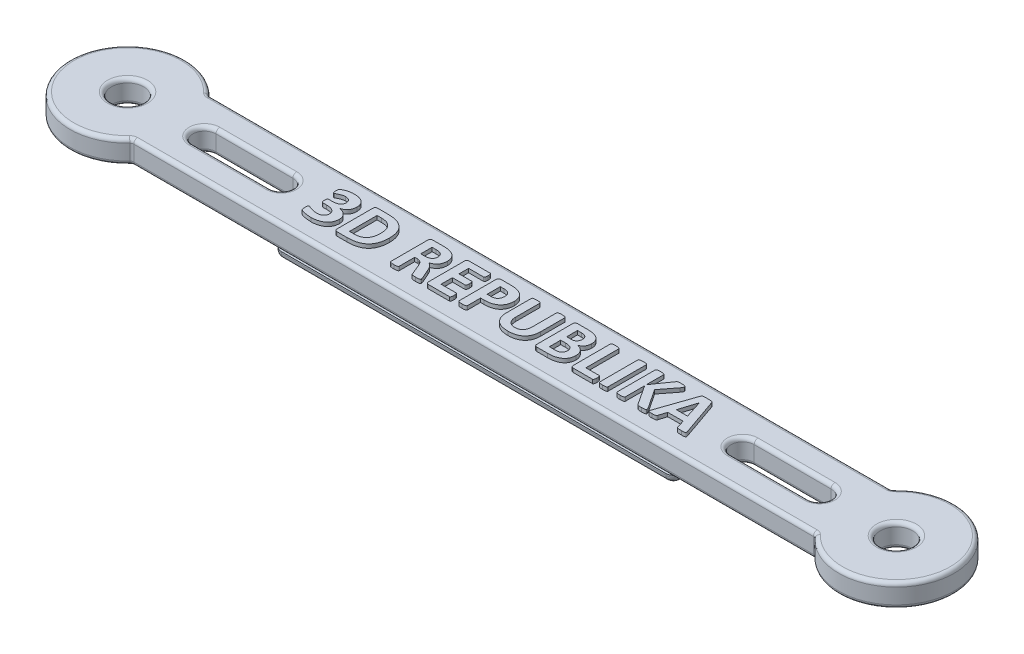
from build123d import *

# Parameters (mm, degrees)
SKETCH1_R           = 2.1
BOSS_EXTRUDE1_DEPTH = 3
BOSS_EXTRUDE2_DEPTH = 0.5
CUT_EXTRUDE1_DEPTH  = 6
SKETCH4_W           = 52
SKETCH4_H           = 10
BOSS_EXTRUDE3_DEPTH = 1
FILLET1_R           = 1
FILLET2_R           = 0.8
FILLET3_R           = 0.5


with BuildPart() as part:
    # Sketch1 → Boss-Extrude1 (new body)
    with BuildSketch(Plane(origin=(0, 0, 0), x_dir=(1, 0, 0), z_dir=(0, 1, 0))):
        with BuildLine():
            Line((5.590169944, 5), (94.409830056, 5))
            ThreePointArc((94.409830056, 5), (107.5, 0), (94.409830056, -5))
            Line((94.409830056, -5), (5.590169944, -5))
            ThreePointArc((5.590169944, -5), (-7.5, 0), (5.590169944, 5))
        make_face()
        with Locations(Location((0, 0, 0), (0, 0, 270))):
            Circle(SKETCH1_R, mode=Mode.SUBTRACT)
        with Locations(Location((100, 0, 0), (0, 0, 270))):
            Circle(SKETCH1_R, mode=Mode.SUBTRACT)
    extrude(amount=BOSS_EXTRUDE1_DEPTH)

    # Sketch2 → Boss-Extrude2 (add)
    # profile 1 of 11: a face of its own
    with BuildSketch(Plane(origin=(0, 3, 0), x_dir=(1, 0, 0), z_dir=(0, 1, 0))):
        with BuildLine():
            add(Edge.make_bspline(
                [(28.638786765, -1.080574708), (28.636898147, -1.145115168), (28.633220992, -1.27077595), (28.605128722, -1.454230842), (28.556381389, -1.625964737), (28.48920155, -1.78633027), (28.404760487, -1.934319512), (28.304419794, -2.069928773), (28.189313461, -2.193386373), (28.060009717, -2.304915373), (27.915137095, -2.40130189), (27.759049483, -2.489124431), (27.587730195, -2.561189115), (27.404418496, -2.621989464), (27.209915705, -2.668792237), (27.006030414, -2.703227842), (26.792981859, -2.722214214), (26.64796189, -2.725336245), (26.574161305, -2.726925045)],
                knots=[0, 0, 0, 0, 1.041492781, 2.0277946, 2.986615217, 3.916084947, 4.827326187, 5.730145009, 6.632774193, 7.546712009, 8.479353451, 9.436923451, 10.433370232, 11.473958583, 12.551323838, 13.6590864, 14.808710327, 16, 16, 16, 16], degree=3))
            add(Edge.make_bspline(
                [(26.574161305, -2.726925045), (26.485767658, -2.725489316), (26.313997798, -2.722699353), (26.066654257, -2.702383046), (25.842163195, -2.669032227), (25.644282902, -2.631465608), (25.477041492, -2.587439196), (25.357653387, -2.549977138), (25.279321365, -2.520208718), (25.236212259, -2.497205355), (25.200764243, -2.480043417), (25.169141325, -2.456550872), (25.142573564, -2.423836499), (25.11618115, -2.382713645), (25.101286336, -2.333570701), (25.083554995, -2.278740505), (25.072308331, -2.211699253), (25.063959702, -2.130516012), (25.059414023, -2.032684052), (25.059229835, -1.961711485), (25.059129902, -1.923204533)],
                knots=[0, 0, 0, 0, 2.385463348, 4.63552214, 6.691379175, 8.508363939, 10.068373641, 11.355199768, 11.885343137, 12.325603242, 12.673057316, 12.946516072, 13.380756177, 13.802840454, 14.256089577, 14.757944138, 15.358657778, 16.084637987, 16.960799159, 18, 18, 18, 18], degree=3))
            add(Edge.make_bspline(
                [(25.059129902, -1.923204533), (25.059599066, -1.891579692), (25.060460227, -1.833531646), (25.066356671, -1.754311686), (25.075114855, -1.690615068), (25.088847226, -1.641113705), (25.109610175, -1.605347057), (25.132131835, -1.578495895), (25.161191849, -1.562135134), (25.182148284, -1.560488778), (25.192880668, -1.559645633)],
                knots=[0, 0, 0, 0, 1.790768318, 3.286992072, 4.494486466, 5.430989523, 6.17113783, 6.821101772, 7.396252803, 8, 8, 8, 8], degree=3))
            add(Edge.make_bspline(
                [(25.192880668, -1.559645633), (25.201018254, -1.560691123), (25.219990193, -1.563128575), (25.25233434, -1.572269115), (25.291629292, -1.588145644), (25.357793084, -1.621094743), (25.459632588, -1.664622014), (25.603386953, -1.72016273), (25.775387333, -1.773026416), (25.935251675, -1.817712866), (26.078004207, -1.84423869), (26.195188679, -1.86045008), (26.319931522, -1.868265874), (26.405141484, -1.870019261), (26.448921952, -1.870920143)],
                knots=[0, 0, 0, 0, 0.226170732, 0.52729361, 0.923950562, 1.394186568, 2.566047078, 3.978394295, 5.644273913, 7.529535004, 8.553841311, 9.648332238, 10.791724437, 12, 12, 12, 12], degree=3))
            add(Edge.make_bspline(
                [(26.448921952, -1.870920143), (26.485821157, -1.870128847), (26.557723675, -1.868586911), (26.662267514, -1.859287976), (26.760113153, -1.841909885), (26.8789259, -1.81241463), (27.012624932, -1.759334176), (27.130407168, -1.686664262), (27.208136588, -1.616903772), (27.259012178, -1.560979119), (27.299797157, -1.498367988), (27.34653109, -1.40888404), (27.386489362, -1.283123543), (27.391248037, -1.177371307), (27.393688725, -1.12313177)],
                knots=[0, 0, 0, 0, 0.976466172, 1.902761238, 2.773765462, 3.603517434, 5.138967444, 6.561136168, 7.237124531, 7.897970486, 8.55532634, 9.207676539, 10.567838014, 12, 12, 12, 12], degree=3))
            add(Edge.make_bspline(
                [(27.393688725, -1.12313177), (27.392658795, -1.093096634), (27.390630357, -1.033942707), (27.377528996, -0.947681354), (27.354034642, -0.866020429), (27.320978138, -0.789451192), (27.279525554, -0.716794501), (27.228129953, -0.650043905), (27.168092367, -0.588322091), (27.097821575, -0.534012183), (27.019735199, -0.483498256), (26.931490793, -0.439947363), (26.833775971, -0.402301116), (26.72671065, -0.371182544), (26.610264343, -0.345162739), (26.484212861, -0.32764451), (26.348205782, -0.316395377), (26.254399744, -0.315178722), (26.205738741, -0.314547594)],
                knots=[0, 0, 0, 0, 0.89089672, 1.75461298, 2.58026117, 3.404244835, 4.222861616, 5.054787265, 5.896384784, 6.769420796, 7.683141108, 8.650860844, 9.682268865, 10.785377137, 11.954998644, 13.218181726, 14.556957852, 16, 16, 16, 16], degree=3))
            Line((26.205738741, -0.314547594), (25.730315564, -0.314547594))
            add(Edge.make_bspline(
                [(25.730315564, -0.314547594), (25.713316735, -0.313670791), (25.681429983, -0.312026067), (25.635745188, -0.304599896), (25.598229653, -0.279548268), (25.568032616, -0.240875895), (25.547505834, -0.185497137), (25.533005291, -0.113421314), (25.527362438, -0.021589668), (25.526511886, 0.046583827), (25.526041667, 0.084272872)],
                knots=[0, 0, 0, 0, 0.79308653, 1.487687939, 2.114642529, 2.838260568, 3.733667445, 4.83079756, 6.247937647, 8, 8, 8, 8], degree=3))
            add(Edge.make_bspline(
                [(25.526041667, 0.084272872), (25.526310974, 0.119548207), (25.526797988, 0.183340021), (25.53466958, 0.269767505), (25.548729314, 0.337199637), (25.56732761, 0.389127914), (25.59523801, 0.425669166), (25.630721725, 0.448561597), (25.672518695, 0.462682562), (25.70303102, 0.463305212), (25.719372319, 0.46363868)],
                knots=[0, 0, 0, 0, 1.741750126, 3.149775881, 4.276488068, 5.138753266, 5.851461045, 6.500941457, 7.197158351, 8, 8, 8, 8], degree=3))
            Line((25.719372319, 0.46363868), (26.204522825, 0.46363868))
            add(Edge.make_bspline(
                [(26.204522825, 0.46363868), (26.244662634, 0.464432807), (26.323035215, 0.465983333), (26.437276194, 0.475294854), (26.544410968, 0.492646353), (26.644751687, 0.514984748), (26.737018613, 0.546081936), (26.822577577, 0.580560594), (26.899983276, 0.622290168), (26.969258672, 0.670028262), (27.032299852, 0.721933915), (27.085208605, 0.78110652), (27.132865373, 0.843225986), (27.170080498, 0.91214871), (27.200656003, 0.984931915), (27.222936244, 1.061970379), (27.234707992, 1.142975505), (27.236924133, 1.198018162), (27.238051471, 1.226018046)],
                knots=[0, 0, 0, 0, 1.332917476, 2.602508262, 3.801673442, 4.934435479, 6.011130419, 7.030807204, 7.994227283, 8.923681384, 9.821417638, 10.697715368, 11.553625213, 12.41501901, 13.289765312, 14.171522894, 15.06986416, 16, 16, 16, 16], degree=3))
            add(Edge.make_bspline(
                [(27.238051471, 1.226018046), (27.236202938, 1.268846094), (27.23252806, 1.353988146), (27.195456464, 1.475443391), (27.140252823, 1.587018744), (27.059813402, 1.682860927), (26.956281218, 1.763197917), (26.825673202, 1.820123319), (26.671226529, 1.859294998), (26.559446612, 1.862610465), (26.499990426, 1.864373975)],
                knots=[0, 0, 0, 0, 0.93045579, 1.849743768, 2.742139225, 3.626153135, 4.551526381, 5.57085846, 6.707929868, 8, 8, 8, 8], degree=3))
            add(Edge.make_bspline(
                [(26.499990426, 1.864373975), (26.430348984, 1.862084662), (26.293502381, 1.857586124), (26.098600574, 1.807283928), (25.920553013, 1.744240268), (25.761181728, 1.675247284), (25.623111067, 1.606001607), (25.522987442, 1.550344608), (25.454829043, 1.511065391), (25.412421409, 1.492104069), (25.377343974, 1.478029686), (25.355493963, 1.476108175), (25.346086091, 1.475280837)],
                knots=[0, 0, 0, 0, 1.692851243, 3.326481149, 4.875633421, 6.295533233, 7.554214611, 8.63713989, 9.087961584, 9.468005232, 9.770941144, 10, 10, 10, 10], degree=3))
            add(Edge.make_bspline(
                [(25.346086091, 1.475280837), (25.335943981, 1.476108626), (25.316372692, 1.477706015), (25.286709235, 1.486747754), (25.26440454, 1.512261943), (25.243812118, 1.547486503), (25.232719587, 1.600211988), (25.220997935, 1.668912493), (25.216333813, 1.758562447), (25.215325902, 1.825071956), (25.214767157, 1.861942142)],
                knots=[0, 0, 0, 0, 0.544926314, 1.051547597, 1.602457595, 2.300384307, 3.219077597, 4.446569629, 6.030121648, 8, 8, 8, 8], degree=3))
            add(Edge.make_bspline(
                [(25.214767157, 1.861942142), (25.21518966, 1.893141082), (25.21595251, 1.949472193), (25.216766787, 2.026736491), (25.22480699, 2.089565414), (25.233627971, 2.141541932), (25.247482915, 2.184344301), (25.265126865, 2.22209828), (25.291558949, 2.257797706), (25.320578878, 2.288734717), (25.353494784, 2.317488015), (25.391570547, 2.34131945), (25.438131298, 2.373010128), (25.520002616, 2.422031201), (25.645241337, 2.485868278), (25.822029946, 2.556911645), (26.029312482, 2.622555573), (26.266374065, 2.674647033), (26.528679147, 2.714793317), (26.712608168, 2.71847638), (26.807617188, 2.720378877)],
                knots=[0, 0, 0, 0, 0.831243847, 1.500848755, 2.055163156, 2.516681738, 2.902423399, 3.250031968, 3.621461942, 4.079686637, 4.378246769, 4.782427033, 5.273426863, 5.878783658, 7.322258244, 9.012066047, 10.947769655, 13.105609809, 15.471789883, 18, 18, 18, 18], degree=3))
            add(Edge.make_bspline(
                [(26.807617188, 2.720378877), (26.87005809, 2.719015995), (26.991899115, 2.716356602), (27.168839784, 2.701452398), (27.334561901, 2.67293921), (27.48932137, 2.63468182), (27.63254663, 2.584435903), (27.765231386, 2.526740894), (27.884992433, 2.457081155), (27.992400315, 2.377289655), (28.089955648, 2.289724703), (28.173657304, 2.190867011), (28.245451781, 2.082434232), (28.302964142, 1.964329583), (28.350008373, 1.838294381), (28.382277091, 1.703985099), (28.402373601, 1.561818254), (28.404328833, 1.464407638), (28.405330882, 1.414485035)],
                knots=[0, 0, 0, 0, 1.280928197, 2.499477094, 3.637948789, 4.726741803, 5.765243399, 6.747765652, 7.690257354, 8.599760521, 9.488354541, 10.372934014, 11.249113775, 12.148837875, 13.061526967, 14.003138316, 14.976615292, 16, 16, 16, 16], degree=3))
            add(Edge.make_bspline(
                [(28.405330882, 1.414485035), (28.404771852, 1.375537367), (28.403668406, 1.298660169), (28.390652934, 1.185379555), (28.371994471, 1.075822635), (28.343605689, 0.971065664), (28.308381206, 0.871015818), (28.266045963, 0.776045318), (28.215690795, 0.686691105), (28.158582215, 0.602726227), (28.094310581, 0.524074636), (28.020096451, 0.453754321), (27.940062881, 0.387668454), (27.851936497, 0.328264397), (27.757393325, 0.274041427), (27.654397065, 0.230129324), (27.545630441, 0.189859263), (27.469294303, 0.170697466), (27.430166207, 0.160875583)],
                knots=[0, 0, 0, 0, 1.079184165, 2.130157228, 3.157254539, 4.15751249, 5.134787611, 6.095384903, 7.036128748, 7.974184748, 8.907856497, 9.845508656, 10.80367147, 11.782237576, 12.788472904, 13.819802145, 14.882482248, 16, 16, 16, 16], degree=3))
            Line((27.430166207, 0.160875583), (27.430166207, 0.148716422))
            add(Edge.make_bspline(
                [(27.430166207, 0.148716422), (27.476133398, 0.142739871), (27.566395159, 0.131004238), (27.696540912, 0.098138501), (27.82019636, 0.058796295), (27.93559315, 0.008240081), (28.044017379, -0.048542213), (28.144135526, -0.11275147), (28.234782976, -0.185506041), (28.317108849, -0.263915781), (28.390760199, -0.348610418), (28.455329576, -0.438444263), (28.510384178, -0.534312603), (28.556773672, -0.635123234), (28.592797454, -0.74076786), (28.62036781, -0.850412423), (28.636208822, -0.96418729), (28.637923892, -1.041618262), (28.638786765, -1.080574708)],
                knots=[0, 0, 0, 0, 1.172328645, 2.301999484, 3.392078591, 4.453589995, 5.486151113, 6.487823821, 7.458763684, 8.423832188, 9.361912792, 10.29572017, 11.219555772, 12.156064298, 13.10018411, 14.040729813, 15.014267802, 16, 16, 16, 16], degree=3))
        make_face()
    # profile 2 of 11: a face of its own
    with BuildSketch(Plane(origin=(0, 3, 0), x_dir=(1, 0, 0), z_dir=(0, 1, 0))):
        with BuildLine():
            add(Edge.make_bspline(
                [(34.008272059, 0.074545543), (34.00595663, -0.042669483), (34.001490739, -0.26874833), (33.966936259, -0.594862022), (33.906069762, -0.894336745), (33.8230671, -1.168634359), (33.715077035, -1.41666638), (33.588524203, -1.641888397), (33.439608593, -1.842755012), (33.268613718, -2.018911991), (33.079156723, -2.174015258), (32.867937997, -2.303526367), (32.638989209, -2.41433652), (32.389041097, -2.501227136), (32.117885279, -2.568151941), (31.82334, -2.614339449), (31.504501463, -2.644121979), (31.283475606, -2.647406748), (31.169108073, -2.649106418)],
                knots=[0, 0, 0, 0, 1.243175404, 2.397778444, 3.472761405, 4.480405584, 5.431589256, 6.336490324, 7.215227396, 8.075654219, 8.934403963, 9.805249972, 10.697439506, 11.627471004, 12.606546335, 13.656101203, 14.787173923, 16, 16, 16, 16], degree=3))
            Line((31.169108073, -2.649106418), (29.894828048, -2.649106418))
            add(Edge.make_bspline(
                [(29.894828048, -2.649106418), (29.872869886, -2.648221699), (29.830453971, -2.646512716), (29.769083558, -2.631833711), (29.714328152, -2.605172236), (29.662918528, -2.572187097), (29.621531122, -2.523923282), (29.592656306, -2.463139671), (29.575680057, -2.390200754), (29.573682716, -2.337930836), (29.572610294, -2.309865839)],
                knots=[0, 0, 0, 0, 0.989814838, 1.911995202, 2.819749916, 3.727320558, 4.647324254, 5.644705951, 6.735385014, 8, 8, 8, 8], degree=3))
            Line((29.572610294, -2.309865839), (29.572610294, 2.30331967))
            add(Edge.make_bspline(
                [(29.572610294, 2.30331967), (29.573704613, 2.331376044), (29.575742738, 2.3836299), (29.592371015, 2.456316756), (29.621844017, 2.516466215), (29.663257551, 2.564303505), (29.713928061, 2.598807939), (29.76913514, 2.625211146), (29.830439875, 2.639987424), (29.872865078, 2.641682652), (29.894828048, 2.642560249)],
                knots=[0, 0, 0, 0, 1.265556281, 2.357047171, 3.338775584, 4.259464068, 5.178151251, 6.086581637, 7.00944841, 8, 8, 8, 8], degree=3))
            Line((29.894828048, 2.642560249), (31.263949525, 2.642560249))
            add(Edge.make_bspline(
                [(31.263949525, 2.642560249), (31.378333575, 2.641076307), (31.599064915, 2.638212686), (31.915969302, 2.605751966), (32.20685234, 2.556335887), (32.470976464, 2.4830317), (32.71262859, 2.389945947), (32.933352252, 2.276950754), (33.134964795, 2.14372163), (33.315282798, 1.989339777), (33.477840906, 1.81711461), (33.617551746, 1.623594133), (33.737679263, 1.411652651), (33.835813432, 1.180560291), (33.913990669, 0.931009581), (33.969482668, 0.662253666), (34.002351664, 0.374482837), (34.00626226, 0.176365388), (34.008272059, 0.074545543)],
                knots=[0, 0, 0, 0, 1.277050956, 2.464374778, 3.553925469, 4.568720637, 5.520324638, 6.441488827, 7.332886579, 8.212750293, 9.087065341, 9.971678865, 10.871724059, 11.802536527, 12.770367558, 13.787784366, 14.863061016, 16, 16, 16, 16], degree=3))
        make_face()
        with BuildLine():
            add(Edge.make_bspline(
                [(32.918811275, 0.033204397), (32.917399487, 0.094423961), (32.914618011, 0.215037584), (32.899934656, 0.392890034), (32.869253358, 0.563493841), (32.832031506, 0.728028868), (32.779395211, 0.883371476), (32.715457492, 1.029598993), (32.635706142, 1.163910657), (32.542772525, 1.287470486), (32.436956753, 1.399985307), (32.316071749, 1.49963147), (32.180997769, 1.585877904), (32.029674261, 1.658606016), (31.859654009, 1.718083731), (31.666354528, 1.757937842), (31.449383202, 1.782064189), (31.296849279, 1.785006173), (31.216528799, 1.786555347)],
                knots=[0, 0, 0, 0, 1.049671709, 2.068043274, 3.054904578, 4.018828307, 4.956968303, 5.862032753, 6.749730628, 7.627916009, 8.507639081, 9.390976117, 10.306434196, 11.247963956, 12.263083484, 13.385942348, 14.623503813, 16, 16, 16, 16], degree=3))
            Line((31.216528799, 1.786555347), (30.662071078, 1.786555347))
            Line((30.662071078, 1.786555347), (30.662071078, -1.793101516))
            Line((30.662071078, -1.793101516), (31.233551624, -1.793101516))
            add(Edge.make_bspline(
                [(31.233551624, -1.793101516), (31.305744062, -1.791684524), (31.44476932, -1.788955739), (31.644156283, -1.768771551), (31.825881101, -1.733935144), (31.990621826, -1.683936451), (32.140572349, -1.619364257), (32.276311287, -1.539313345), (32.40097411, -1.447004864), (32.510258996, -1.337257262), (32.608741637, -1.215169472), (32.692418044, -1.077918483), (32.763532006, -0.927150338), (32.819806429, -0.762116189), (32.865474836, -0.583343061), (32.895592443, -0.390341821), (32.916073961, -0.183264201), (32.917877794, -0.040615912), (32.918811275, 0.033204397)],
                knots=[0, 0, 0, 0, 1.212269993, 2.334540203, 3.361079872, 4.314908462, 5.2202939, 6.09584052, 6.956200862, 7.817745089, 8.689420289, 9.584823335, 10.510451266, 11.483443694, 12.508628493, 13.60525822, 14.760724163, 16, 16, 16, 16], degree=3))
        make_face(mode=Mode.SUBTRACT)
    # profile 3 of 11: a face of its own
    with BuildSketch(Plane(origin=(0, 3, 0), x_dir=(1, 0, 0), z_dir=(0, 1, 0))):
        with BuildLine():
            add(Edge.make_bspline(
                [(40.70067402, -2.487389582), (40.700218889, -2.500865319), (40.69935056, -2.526575256), (40.685554881, -2.563576245), (40.653940981, -2.595746521), (40.598908194, -2.616593315), (40.520291768, -2.632531611), (40.437413801, -2.641331987), (40.355007827, -2.646330653), (40.279132293, -2.646078769), (40.192447644, -2.650018208), (40.131225237, -2.649422151), (40.098795573, -2.649106418)],
                knots=[0, 0, 0, 0, 0.591319522, 1.128160102, 1.696130589, 2.518752957, 3.670424272, 5.233177541, 6.180486275, 7.30487453, 8.572385225, 10, 10, 10, 10], degree=3))
            add(Edge.make_bspline(
                [(40.098795573, -2.649106418), (40.046929574, -2.648339075), (39.95451581, -2.646971841), (39.831280628, -2.64460227), (39.73607975, -2.631958054), (39.663313301, -2.615517296), (39.609241097, -2.590416396), (39.57274129, -2.556028631), (39.55170437, -2.514180405), (39.539684915, -2.485418907), (39.533394608, -2.470366758)],
                knots=[0, 0, 0, 0, 1.94662298, 3.468452578, 4.619005538, 5.544708335, 6.258749361, 6.828725966, 7.387021064, 8, 8, 8, 8], degree=3))
            Line((39.533394608, -2.470366758), (39.05189185, -1.293360017))
            add(Edge.make_bspline(
                [(39.05189185, -1.293360017), (39.023615228, -1.229895711), (38.970179182, -1.109963372), (38.886449038, -0.942773892), (38.800756256, -0.797956746), (38.701851024, -0.679694057), (38.59072755, -0.585047301), (38.46200791, -0.518415724), (38.315196971, -0.476455153), (38.210786722, -0.472348884), (38.155761719, -0.470184849)],
                knots=[0, 0, 0, 0, 1.274400747, 2.408312201, 3.429775496, 4.353228678, 5.22430954, 6.089020439, 6.992899086, 8, 8, 8, 8], degree=3))
            Line((38.155761719, -0.470184849), (37.821384804, -0.470184849))
            Line((37.821384804, -0.470184849), (37.821384804, -2.477662254))
            add(Edge.make_bspline(
                [(37.821384804, -2.477662254), (37.820366012, -2.490911003), (37.818289827, -2.517910499), (37.795313653, -2.554850201), (37.75707915, -2.585440465), (37.700840154, -2.607378459), (37.626741487, -2.624641701), (37.531675658, -2.639457718), (37.411731495, -2.64684285), (37.323271758, -2.648299007), (37.27422258, -2.649106418)],
                knots=[0, 0, 0, 0, 0.508410858, 1.036085586, 1.626982877, 2.379311475, 3.350140591, 4.573428586, 6.100033754, 8, 8, 8, 8], degree=3))
            add(Edge.make_bspline(
                [(37.27422258, -2.649106418), (37.226392822, -2.648266728), (37.138751703, -2.646728118), (37.0191839, -2.639455826), (36.923388403, -2.624652429), (36.848964718, -2.607764736), (36.793834121, -2.584945791), (36.755060162, -2.555569079), (36.735548478, -2.517194354), (36.733128931, -2.490804267), (36.73192402, -2.477662254)],
                knots=[0, 0, 0, 0, 1.863476628, 3.41455158, 4.660430775, 5.63680735, 6.378967734, 6.973241497, 7.488684008, 8, 8, 8, 8], degree=3))
            Line((36.73192402, -2.477662254), (36.73192402, 2.304535586))
            add(Edge.make_bspline(
                [(36.73192402, 2.304535586), (36.733115269, 2.332163511), (36.735365943, 2.384362009), (36.751147768, 2.456930279), (36.781514268, 2.516725347), (36.822449502, 2.563876802), (36.872175482, 2.599170162), (36.927273496, 2.625152108), (36.988130147, 2.639905588), (37.030151254, 2.641660104), (37.051709942, 2.642560249)],
                knots=[0, 0, 0, 0, 1.255139882, 2.371383969, 3.342844043, 4.269311035, 5.178797513, 6.092929471, 7.021588424, 8, 8, 8, 8], degree=3))
            Line((37.051709942, 2.642560249), (38.423263251, 2.642560249))
            add(Edge.make_bspline(
                [(38.423263251, 2.642560249), (38.456501935, 2.64281417), (38.520152663, 2.643300417), (38.610916699, 2.640008366), (38.69242442, 2.6382589), (38.786452722, 2.633022264), (38.89235813, 2.626673859), (38.974093274, 2.618488664), (39.012982537, 2.61459418)],
                knots=[0, 0, 0, 0, 1.012794642, 1.939460509, 2.767356448, 3.497015972, 4.809089956, 6, 6, 6, 6], degree=3))
            add(Edge.make_bspline(
                [(39.012982537, 2.61459418), (39.06495524, 2.606214459), (39.167017857, 2.589758585), (39.315707278, 2.556379866), (39.455486105, 2.511962762), (39.587538077, 2.461360614), (39.710810981, 2.401596245), (39.82483681, 2.333853737), (39.929776351, 2.25811964), (40.023130796, 2.172504878), (40.107780809, 2.079618247), (40.182653598, 1.978775283), (40.244467024, 1.867896298), (40.296975256, 1.749988598), (40.338504226, 1.623325303), (40.369188436, 1.488295936), (40.385750455, 1.343564636), (40.38815932, 1.244296138), (40.38939951, 1.193188313)],
                knots=[0, 0, 0, 0, 1.151418638, 2.261125421, 3.329441394, 4.356764664, 5.35198948, 6.322018693, 7.254748064, 8.177310221, 9.087349105, 10.000534908, 10.917628462, 11.858287172, 12.819893749, 13.828610564, 14.882072401, 16, 16, 16, 16], degree=3))
            add(Edge.make_bspline(
                [(40.38939951, 1.193188313), (40.38900425, 1.149769994), (40.388233835, 1.065141874), (40.373283864, 0.941021828), (40.354262052, 0.82228436), (40.322878763, 0.710002119), (40.285395086, 0.603821486), (40.240227146, 0.50313024), (40.186586165, 0.408536862), (40.12581392, 0.318903957), (40.055672686, 0.236277597), (39.979230628, 0.158239022), (39.894834367, 0.085865464), (39.769818074, -0.001810575), (39.596473517, -0.100468079), (39.444819999, -0.154315363), (39.366814108, -0.182012744)],
                knots=[0, 0, 0, 0, 0.984128184, 1.918197676, 2.832650415, 3.70915726, 4.55828255, 5.385371142, 6.208721057, 7.022207663, 7.837977017, 8.663633597, 9.498301217, 10.355451789, 12.125356837, 14, 14, 14, 14], degree=3))
            add(Edge.make_bspline(
                [(39.366814108, -0.182012744), (39.406627889, -0.202225309), (39.486275167, -0.242660448), (39.597411837, -0.319312334), (39.703019326, -0.409012216), (39.799889362, -0.51761881), (39.892262535, -0.641718986), (39.978803218, -0.7833654), (40.061590501, -0.942603084), (40.112376842, -1.056373233), (40.138920803, -1.115836274)],
                knots=[0, 0, 0, 0, 0.862491229, 1.725409574, 2.603460875, 3.535458815, 4.5322819, 5.591415034, 6.741130359, 8, 8, 8, 8], degree=3))
            Line((40.138920803, -1.115836274), (40.596105239, -2.150580836))
            add(Edge.make_bspline(
                [(40.596105239, -2.150580836), (40.605968183, -2.174440729), (40.624113658, -2.218337263), (40.647263888, -2.279684927), (40.665741567, -2.330703827), (40.68241184, -2.382313572), (40.696860264, -2.433097252), (40.699529902, -2.471102009), (40.70067402, -2.487389582)],
                knots=[0, 0, 0, 0, 1.311865282, 2.41352042, 3.332073222, 4.068080627, 5.172043703, 6, 6, 6, 6], degree=3))
        make_face()
        with BuildLine():
            add(Edge.make_bspline(
                [(39.299938725, 1.057005715), (39.298742374, 1.09846482), (39.296423147, 1.178836751), (39.272752867, 1.293983092), (39.234833182, 1.398973188), (39.182318637, 1.494402979), (39.112047704, 1.578654142), (39.021882536, 1.649306354), (38.912223969, 1.705243494), (38.830669687, 1.729895696), (38.788038067, 1.742782369)],
                knots=[0, 0, 0, 0, 1.06541259, 2.065391104, 3.008807556, 3.928413024, 4.853617449, 5.811161198, 6.855808141, 8, 8, 8, 8], degree=3))
            add(Edge.make_bspline(
                [(38.788038067, 1.742782369), (38.758528176, 1.749271871), (38.69625772, 1.762965729), (38.613965239, 1.773648728), (38.538798087, 1.779448161), (38.47119491, 1.785373849), (38.39325662, 1.785060976), (38.338144039, 1.786038069), (38.308967142, 1.786555347)],
                knots=[0, 0, 0, 0, 1.127497783, 2.379195572, 3.092833242, 3.942220738, 4.910600581, 6, 6, 6, 6], degree=3))
            Line((38.308967142, 1.786555347), (37.821384804, 1.786555347))
            Line((37.821384804, 1.786555347), (37.821384804, 0.308001426))
            Line((37.821384804, 0.308001426), (38.374626608, 0.308001426))
            add(Edge.make_bspline(
                [(38.374626608, 0.308001426), (38.411932931, 0.308772868), (38.484244508, 0.310268171), (38.589571022, 0.319770232), (38.687484314, 0.336751753), (38.778826073, 0.359615332), (38.862036873, 0.390026185), (38.93870131, 0.425535298), (39.007745727, 0.466470428), (39.089204125, 0.528124641), (39.173797952, 0.619911558), (39.247531473, 0.750479665), (39.292208598, 0.898516445), (39.297314091, 1.003193361), (39.299938725, 1.057005715)],
                knots=[0, 0, 0, 0, 0.997048219, 1.932598153, 2.822976353, 3.650522851, 4.445456231, 5.186855846, 5.905759209, 6.586005233, 7.91212848, 9.207278324, 10.564316464, 12, 12, 12, 12], degree=3))
        make_face(mode=Mode.SUBTRACT)
    # profile 4 of 11: a face of its own
    with BuildSketch(Plane(origin=(0, 3, 0), x_dir=(1, 0, 0), z_dir=(0, 1, 0))):
        with BuildLine():
            add(Edge.make_bspline(
                [(44.66942402, -2.221103967), (44.669249288, -2.258020888), (44.668929957, -2.325488701), (44.659792589, -2.417160043), (44.64908861, -2.491722858), (44.631038209, -2.550043584), (44.607924937, -2.595045659), (44.578592965, -2.626676412), (44.543933762, -2.645180954), (44.519649342, -2.647812381), (44.507707184, -2.649106418)],
                knots=[0, 0, 0, 0, 1.772437912, 3.239232977, 4.423707261, 5.384401224, 6.159891517, 6.834724464, 7.426961607, 8, 8, 8, 8], degree=3))
            Line((44.507707184, -2.649106418), (41.803509881, -2.649106418))
            add(Edge.make_bspline(
                [(41.803509881, -2.649106418), (41.781559663, -2.648180677), (41.738765133, -2.646375836), (41.676908694, -2.632060893), (41.621729556, -2.605214674), (41.570415037, -2.571815223), (41.527645909, -2.524390782), (41.498982072, -2.463072351), (41.481906735, -2.390221476), (41.479924568, -2.337938075), (41.478860294, -2.309865839)],
                knots=[0, 0, 0, 0, 0.986134925, 1.922585978, 2.82696586, 3.731162354, 4.659788764, 5.653462416, 6.740086574, 8, 8, 8, 8], degree=3))
            Line((41.478860294, -2.309865839), (41.478860294, 2.30331967))
            add(Edge.make_bspline(
                [(41.478860294, 2.30331967), (41.479946278, 2.331383668), (41.481968877, 2.383651725), (41.498698037, 2.456246306), (41.527960695, 2.516940123), (41.570779179, 2.563883132), (41.621565266, 2.599211181), (41.677904503, 2.625156512), (41.740339908, 2.639999213), (41.783570675, 2.641686904), (41.805941713, 2.642560249)],
                knots=[0, 0, 0, 0, 1.255398639, 2.338128977, 3.311977815, 4.237276575, 5.148590167, 6.066205518, 6.999300883, 8, 8, 8, 8], degree=3))
            Line((41.805941713, 2.642560249), (44.510139017, 2.642560249))
            add(Edge.make_bspline(
                [(44.510139017, 2.642560249), (44.522073391, 2.641732565), (44.545858291, 2.640083011), (44.57929391, 2.622919658), (44.608016287, 2.591925426), (44.62931614, 2.545483356), (44.64944702, 2.485832853), (44.659538951, 2.409728479), (44.66907773, 2.316942378), (44.669300775, 2.248647073), (44.66942402, 2.21091005)],
                knots=[0, 0, 0, 0, 0.566414176, 1.128848811, 1.744661206, 2.549421896, 3.546753268, 4.742756138, 6.200188366, 8, 8, 8, 8], degree=3))
            add(Edge.make_bspline(
                [(44.66942402, 2.21091005), (44.669263762, 2.174798499), (44.668969695, 2.108535188), (44.65955051, 2.018143278), (44.649514327, 1.943703633), (44.629748342, 1.885675725), (44.606519157, 1.841527641), (44.579899943, 1.808748888), (44.546006418, 1.790336104), (44.522081051, 1.787814148), (44.510139017, 1.786555347)],
                knots=[0, 0, 0, 0, 1.754513308, 3.219464557, 4.418295359, 5.396805865, 6.181695552, 6.838026381, 7.420016048, 8, 8, 8, 8], degree=3))
            Line((44.510139017, 1.786555347), (42.568321078, 1.786555347))
            Line((42.568321078, 1.786555347), (42.568321078, 0.541457308))
            Line((42.568321078, 0.541457308), (44.195216759, 0.541457308))
            add(Edge.make_bspline(
                [(44.195216759, 0.541457308), (44.207643808, 0.540328116), (44.232691206, 0.538052169), (44.266534348, 0.517524737), (44.297142724, 0.487544333), (44.319620611, 0.442245908), (44.338179808, 0.383373648), (44.348222461, 0.307823414), (44.357727739, 0.21542518), (44.358000345, 0.147946107), (44.35814951, 0.111023025)],
                knots=[0, 0, 0, 0, 0.588344271, 1.185840062, 1.842418932, 2.6128118, 3.567190965, 4.782059029, 6.239212611, 8, 8, 8, 8], degree=3))
            add(Edge.make_bspline(
                [(44.35814951, 0.111023025), (44.357963072, 0.073703388), (44.357622004, 0.005431308), (44.348626677, -0.087078424), (44.337740461, -0.161996695), (44.320056774, -0.220090905), (44.29662155, -0.264235447), (44.267236011, -0.294717498), (44.232094828, -0.312081838), (44.207550042, -0.313722961), (44.195216759, -0.314547594)],
                knots=[0, 0, 0, 0, 1.788442105, 3.271753817, 4.453938487, 5.412775407, 6.169742938, 6.829388584, 7.411790278, 8, 8, 8, 8], degree=3))
            Line((44.195216759, -0.314547594), (42.568321078, -0.314547594))
            Line((42.568321078, -0.314547594), (42.568321078, -1.793101516))
            Line((42.568321078, -1.793101516), (44.507707184, -1.793101516))
            add(Edge.make_bspline(
                [(44.507707184, -1.793101516), (44.519664432, -1.794381924), (44.543979536, -1.796985639), (44.578131466, -1.815571817), (44.608726779, -1.846123163), (44.630562595, -1.892058656), (44.649386161, -1.95077502), (44.659522371, -2.025515265), (44.669042156, -2.117101719), (44.669288445, -2.184179477), (44.66942402, -2.221103967)],
                knots=[0, 0, 0, 0, 0.572817642, 1.164826637, 1.825495256, 2.617848232, 3.578172107, 4.781394644, 6.228244884, 8, 8, 8, 8], degree=3))
        make_face()
    # profile 5 of 11: a face of its own
    with BuildSketch(Plane(origin=(0, 3, 0), x_dir=(1, 0, 0), z_dir=(0, 1, 0))):
        with BuildLine():
            add(Edge.make_bspline(
                [(49.260723039, 1.049710218), (49.259305941, 0.978279823), (49.256541639, 0.838942175), (49.228725534, 0.636296016), (49.186080492, 0.445646295), (49.123462495, 0.268561106), (49.045101323, 0.10440185), (48.95198079, -0.047697377), (48.839466773, -0.184097828), (48.714310188, -0.309370528), (48.57194734, -0.419289334), (48.413705116, -0.514349863), (48.240328967, -0.595539694), (48.052055219, -0.663911187), (47.847820909, -0.717584669), (47.626390859, -0.754255401), (47.387919735, -0.777983768), (47.222908402, -0.780276109), (47.137733609, -0.781459359)],
                knots=[0, 0, 0, 0, 1.074464578, 2.095933629, 3.072557769, 4.010187366, 4.916045523, 5.806428764, 6.686724732, 7.570985258, 8.466598065, 9.386175178, 10.343966936, 11.343562976, 12.397043313, 13.517236352, 14.718458445, 16, 16, 16, 16], degree=3))
            Line((47.137733609, -0.781459359), (46.692708333, -0.781459359))
            Line((46.692708333, -0.781459359), (46.692708333, -2.476446338))
            add(Edge.make_bspline(
                [(46.692708333, -2.476446338), (46.691687525, -2.489690568), (46.689607231, -2.516680857), (46.666664054, -2.553694501), (46.628144668, -2.584041621), (46.572541327, -2.607830408), (46.497982686, -2.624456692), (46.403029723, -2.639526337), (46.283044311, -2.646818775), (46.194591466, -2.64829042), (46.145546109, -2.649106418)],
                knots=[0, 0, 0, 0, 0.508007, 1.035262567, 1.625690476, 2.383776293, 3.353834227, 4.576150498, 6.101543, 8, 8, 8, 8], degree=3))
            add(Edge.make_bspline(
                [(46.145546109, -2.649106418), (46.097716351, -2.648266728), (46.010075233, -2.646728118), (45.89050743, -2.639455826), (45.794711933, -2.624652429), (45.720288248, -2.607764736), (45.665157651, -2.584945791), (45.626383691, -2.555569079), (45.606872008, -2.517194354), (45.60445246, -2.490804267), (45.603247549, -2.477662254)],
                knots=[0, 0, 0, 0, 1.863476628, 3.41455158, 4.660430775, 5.63680735, 6.378967734, 6.973241497, 7.488684008, 8, 8, 8, 8], degree=3))
            Line((45.603247549, -2.477662254), (45.603247549, 2.259546692))
            add(Edge.make_bspline(
                [(45.603247549, 2.259546692), (45.60413118, 2.289671567), (45.605800759, 2.346591139), (45.625659857, 2.425831018), (45.657137905, 2.493566391), (45.702479645, 2.548338966), (45.757265951, 2.59127507), (45.82156929, 2.620610659), (45.893174085, 2.639584043), (45.943978893, 2.641540634), (45.970454197, 2.642560249)],
                knots=[0, 0, 0, 0, 1.197727496, 2.263051323, 3.230895321, 4.148959142, 5.069575903, 5.97979471, 6.947234457, 8, 8, 8, 8], degree=3))
            Line((45.970454197, 2.642560249), (47.230143229, 2.642560249))
            add(Edge.make_bspline(
                [(47.230143229, 2.642560249), (47.291770342, 2.641933012), (47.412288142, 2.640706389), (47.562639826, 2.630730575), (47.684328012, 2.619954664), (47.782338388, 2.605966992), (47.889037887, 2.589008343), (48.003121049, 2.567418222), (48.122675532, 2.540693244), (48.243891685, 2.502586748), (48.365420851, 2.453362821), (48.486774955, 2.395982073), (48.60451039, 2.329929107), (48.713841121, 2.253994373), (48.816062947, 2.171633994), (48.906820161, 2.078645457), (48.989115707, 1.978482735), (49.061168574, 1.869904166), (49.122293588, 1.752511834), (49.171516055, 1.626669696), (49.212445696, 1.494017347), (49.23975635, 1.35296614), (49.257224191, 1.204165611), (49.259537483, 1.102046179), (49.260723039, 1.049710218)],
                knots=[0, 0, 0, 0, 1.38621072, 2.710869615, 3.388616039, 4.133955867, 4.937429859, 5.819054405, 6.745780206, 7.69168535, 8.673727408, 9.693358198, 10.710090274, 11.706587263, 12.684939732, 13.6585218, 14.624043424, 15.597668188, 16.584608242, 17.59543571, 18.633851017, 19.703190502, 20.822890724, 22, 22, 22, 22], degree=3))
        make_face()
        with BuildLine():
            add(Edge.make_bspline(
                [(48.093443627, 0.971891591), (48.092376286, 1.014116319), (48.090323028, 1.0953445), (48.072002195, 1.211335006), (48.042228334, 1.315982426), (47.998914771, 1.407871683), (47.94748856, 1.487856722), (47.891942413, 1.558328242), (47.829025887, 1.61644917), (47.738368731, 1.676795843), (47.617111182, 1.733332904), (47.462292785, 1.767758267), (47.304308539, 1.784110883), (47.197757958, 1.785733728), (47.143813189, 1.786555347)],
                knots=[0, 0, 0, 0, 1.056493055, 2.032387488, 2.931402208, 3.771204896, 4.564998665, 5.308217722, 6.011945206, 6.698641516, 8.028848972, 9.333224699, 10.649856469, 12, 12, 12, 12], degree=3))
            Line((47.143813189, 1.786555347), (46.692708333, 1.786555347))
            Line((46.692708333, 1.786555347), (46.692708333, 0.074545543))
            Line((46.692708333, 0.074545543), (47.16813151, 0.074545543))
            add(Edge.make_bspline(
                [(47.16813151, 0.074545543), (47.208723297, 0.074878723), (47.286505768, 0.075517167), (47.397612049, 0.09044846), (47.499563064, 0.108153992), (47.591063217, 0.137937571), (47.673765809, 0.174729496), (47.748040332, 0.218384577), (47.814344946, 0.268815838), (47.893096599, 0.343714863), (47.97271124, 0.45685139), (48.042173988, 0.612060303), (48.085512996, 0.786401648), (48.090746805, 0.908815477), (48.093443627, 0.971891591)],
                knots=[0, 0, 0, 0, 0.994866053, 1.906374308, 2.74693753, 3.530006713, 4.260007552, 4.964362092, 5.63858968, 6.299709843, 7.624490497, 8.999703561, 10.454038735, 12, 12, 12, 12], degree=3))
        make_face(mode=Mode.SUBTRACT)
    # profile 6 of 11: a face of its own
    with BuildSketch(Plane(origin=(0, 3, 0), x_dir=(1, 0, 0), z_dir=(0, 1, 0))):
        with BuildLine():
            add(Edge.make_bspline(
                [(54.396752451, -0.676890578), (54.395453749, -0.755619254), (54.392921147, -0.909148184), (54.363451244, -1.132760041), (54.319576061, -1.343897748), (54.25626001, -1.541523147), (54.175452151, -1.725206477), (54.078781131, -1.895593473), (53.961378203, -2.049206849), (53.83019929, -2.190407339), (53.680624997, -2.314653642), (53.514631814, -2.423860487), (53.332053085, -2.51731093), (53.132686626, -2.593993272), (52.91783403, -2.652742045), (52.688287188, -2.696966571), (52.442940344, -2.722278897), (52.274226299, -2.725346795), (52.187432981, -2.726925045)],
                knots=[0, 0, 0, 0, 1.101489708, 2.148017032, 3.151833871, 4.117229806, 5.047088268, 5.957085578, 6.852459781, 7.747618215, 8.649923342, 9.567408002, 10.524110649, 11.515664896, 12.552285491, 13.638395751, 14.785095412, 16, 16, 16, 16], degree=3))
            add(Edge.make_bspline(
                [(52.187432981, -2.726925045), (52.105482694, -2.72587662), (51.945655453, -2.72383188), (51.71307345, -2.69773801), (51.492707162, -2.661634361), (51.28594949, -2.606871153), (51.093414765, -2.536449958), (50.91507123, -2.451335748), (50.752725318, -2.348807712), (50.605709222, -2.230181517), (50.474923477, -2.095963783), (50.361074587, -1.945612781), (50.261971526, -1.78092415), (50.18015538, -1.599824381), (50.117544746, -1.402555841), (50.070858399, -1.189826749), (50.044848807, -0.960842484), (50.040925669, -0.803003284), (50.038909314, -0.721879472)],
                knots=[0, 0, 0, 0, 1.172781629, 2.287270233, 3.347240829, 4.367778738, 5.344526095, 6.278927904, 7.191816994, 8.087274261, 8.977828802, 9.868080756, 10.781725816, 11.724523846, 12.706378122, 13.739950459, 14.838413807, 16, 16, 16, 16], degree=3))
            Line((50.038909314, -0.721879472), (50.038909314, 2.472332002))
            add(Edge.make_bspline(
                [(50.038909314, 2.472332002), (50.040044198, 2.485509529), (50.04229212, 2.511610902), (50.062511753, 2.54914763), (50.101019999, 2.578748842), (50.157285077, 2.601080861), (50.232013612, 2.617936509), (50.327832234, 2.632674768), (50.448085168, 2.642232737), (50.537009726, 2.642443801), (50.586071538, 2.642560249)],
                knots=[0, 0, 0, 0, 0.508238353, 1.006692569, 1.597389366, 2.349462696, 3.33519328, 4.558066209, 6.101002562, 8, 8, 8, 8], degree=3))
            add(Edge.make_bspline(
                [(50.586071538, 2.642560249), (50.63392491, 2.642461578), (50.720839175, 2.642282366), (50.838983233, 2.632430805), (50.933781287, 2.618223584), (51.007695053, 2.600683189), (51.064646726, 2.579151442), (51.101496691, 2.547199677), (51.125563182, 2.5111854), (51.127437994, 2.484422073), (51.128370098, 2.471116085)],
                knots=[0, 0, 0, 0, 1.867777539, 3.392373475, 4.625712319, 5.604518018, 6.363027942, 6.968993241, 7.487411907, 8, 8, 8, 8], degree=3))
            Line((51.128370098, 2.471116085), (51.128370098, -0.644060845))
            add(Edge.make_bspline(
                [(51.128370098, -0.644060845), (51.129225838, -0.694763453), (51.130879533, -0.792744975), (51.145758233, -0.934612921), (51.169456232, -1.066137636), (51.203635641, -1.186933973), (51.246245606, -1.297973656), (51.298452837, -1.398424678), (51.358273374, -1.489762745), (51.426886564, -1.570156525), (51.50266048, -1.64184769), (51.58731846, -1.702016003), (51.677586645, -1.755249936), (51.775333948, -1.797450739), (51.879566429, -1.830751076), (51.990147047, -1.852866967), (52.106341784, -1.868412927), (52.185757484, -1.870072189), (52.226342295, -1.870920143)],
                knots=[0, 0, 0, 0, 1.298728395, 2.509760153, 3.650355886, 4.718750055, 5.721541218, 6.692257017, 7.613908022, 8.512753344, 9.394397771, 10.279277603, 11.168048638, 12.074837134, 13.000981889, 13.966350578, 14.960718406, 16, 16, 16, 16], degree=3))
            add(Edge.make_bspline(
                [(52.226342295, -1.870920143), (52.267330495, -1.87006272), (52.347550209, -1.868384622), (52.464188417, -1.853068239), (52.574885889, -1.830785052), (52.67837118, -1.796507932), (52.77479947, -1.752536528), (52.864102598, -1.700037227), (52.946019452, -1.639269453), (53.019831609, -1.568991473), (53.085597735, -1.489860777), (53.142759282, -1.401343008), (53.192926752, -1.3050557), (53.234215588, -1.199846707), (53.266593029, -1.086597313), (53.291505181, -0.965999356), (53.30422784, -0.83766623), (53.306253259, -0.749869128), (53.307291667, -0.704856647)],
                knots=[0, 0, 0, 0, 1.090054203, 2.133390513, 3.125357558, 4.090464733, 5.026701419, 5.940368808, 6.841927319, 7.734410376, 8.64571991, 9.572969714, 10.532820702, 11.530107898, 12.574446933, 13.66364728, 14.80218105, 16, 16, 16, 16], degree=3))
            Line((53.307291667, -0.704856647), (53.307291667, 2.471116085))
            add(Edge.make_bspline(
                [(53.307291667, 2.471116085), (53.308411182, 2.484311515), (53.31062866, 2.510448348), (53.331216727, 2.547943184), (53.368888198, 2.578966364), (53.425774136, 2.600950757), (53.500740742, 2.618112059), (53.597459066, 2.632606289), (53.718084394, 2.642189194), (53.807011346, 2.642429022), (53.855669807, 2.642560249)],
                knots=[0, 0, 0, 0, 0.50661817, 1.003483393, 1.602391239, 2.352067079, 3.33465531, 4.569087731, 6.122696137, 8, 8, 8, 8], degree=3))
            add(Edge.make_bspline(
                [(53.855669807, 2.642560249), (53.903927861, 2.64247162), (53.99124621, 2.642311255), (54.109805439, 2.632435551), (54.204573733, 2.618212324), (54.278566516, 2.600712561), (54.334771763, 2.579281334), (54.371708783, 2.548355916), (54.393673842, 2.512010893), (54.395724775, 2.485577279), (54.396752451, 2.472332002)],
                knots=[0, 0, 0, 0, 1.887028588, 3.414398314, 4.649981048, 5.630567548, 6.390457475, 6.975166295, 7.486479324, 8, 8, 8, 8], degree=3))
            Line((54.396752451, 2.472332002), (54.396752451, -0.676890578))
        make_face()
    # profile 7 of 11: a face of its own
    with BuildSketch(Plane(origin=(0, 3, 0), x_dir=(1, 0, 0), z_dir=(0, 1, 0))):
        with BuildLine():
            add(Edge.make_bspline(
                [(59.377144608, -1.061120051), (59.376252666, -1.106960339), (59.374503541, -1.196854606), (59.359531792, -1.328593115), (59.335611096, -1.453944059), (59.301543578, -1.572311064), (59.258163369, -1.683086354), (59.210064484, -1.788677149), (59.152752708, -1.886996989), (59.087923414, -1.978855468), (59.015810148, -2.063755406), (58.938255421, -2.143648579), (58.852019041, -2.214980094), (58.730049089, -2.305194709), (58.560886819, -2.401281236), (58.341811623, -2.495060346), (58.104890457, -2.56503199), (57.896853252, -2.606044702), (57.721364738, -2.628392762), (57.581013234, -2.640424462), (57.433379312, -2.647764491), (57.332387735, -2.64865332), (57.280905331, -2.649106418)],
                knots=[0, 0, 0, 0, 0.924869681, 1.813698953, 2.671929785, 3.497741784, 4.295238828, 5.071047982, 5.837050105, 6.588235223, 7.337056364, 8.083192266, 8.832013407, 9.592756872, 11.143016317, 12.74439455, 14.392794953, 16.118857481, 17.017754023, 17.961953565, 18.961066516, 20, 20, 20, 20], degree=3))
            Line((57.280905331, -2.649106418), (55.881385953, -2.649106418))
            add(Edge.make_bspline(
                [(55.881385953, -2.649106418), (55.859821209, -2.648243034), (55.818182147, -2.646575939), (55.757781958, -2.631524308), (55.70343792, -2.605572273), (55.653120186, -2.571692911), (55.611474129, -2.524279917), (55.584437586, -2.462763214), (55.566978201, -2.390263894), (55.565061166, -2.337952894), (55.564031863, -2.309865839)],
                knots=[0, 0, 0, 0, 0.978793994, 1.889939582, 2.804428835, 3.703585142, 4.63041425, 5.627232269, 6.726002966, 8, 8, 8, 8], degree=3))
            Line((55.564031863, -2.309865839), (55.564031863, 2.30331967))
            add(Edge.make_bspline(
                [(55.564031863, 2.30331967), (55.565082488, 2.331398801), (55.567039235, 2.383695043), (55.584154978, 2.455932026), (55.611785715, 2.516828292), (55.653470414, 2.563809451), (55.703028665, 2.599206934), (55.757834035, 2.624903104), (55.818168016, 2.640050131), (55.859816387, 2.641703813), (55.881385953, 2.642560249)],
                knots=[0, 0, 0, 0, 1.274945825, 2.374534816, 3.355443708, 4.282963059, 5.193482606, 6.108652912, 7.020477063, 8, 8, 8, 8], degree=3))
            Line((55.881385953, 2.642560249), (57.205518536, 2.642560249))
            add(Edge.make_bspline(
                [(57.205518536, 2.642560249), (57.282960926, 2.641800334), (57.432346832, 2.640334463), (57.646681401, 2.624401612), (57.842797343, 2.599098801), (58.021513417, 2.564639158), (58.184294415, 2.517751521), (58.334057723, 2.462737883), (58.469295932, 2.394056253), (58.591731618, 2.316152493), (58.701614426, 2.228189303), (58.796574184, 2.128144155), (58.877921855, 2.01682302), (58.946394704, 1.895042841), (58.999632635, 1.761645696), (59.039154431, 1.61741832), (59.062133929, 1.461837795), (59.064603842, 1.354170856), (59.065870098, 1.298973009)],
                knots=[0, 0, 0, 0, 1.422535359, 2.744062161, 3.945671556, 5.054054835, 6.084028266, 7.054893494, 7.980650676, 8.864712083, 9.717130842, 10.559835018, 11.390878574, 12.24430494, 13.119573574, 14.022776017, 14.986332244, 16, 16, 16, 16], degree=3))
            add(Edge.make_bspline(
                [(59.065870098, 1.298973009), (59.063625136, 1.23677557), (59.059212161, 1.114512613), (59.021907298, 0.937917992), (58.962365867, 0.774111458), (58.879214052, 0.625665095), (58.772868519, 0.493654642), (58.645380549, 0.37936618), (58.498630089, 0.281025488), (58.388716257, 0.235272746), (58.332672718, 0.211944057)],
                knots=[0, 0, 0, 0, 1.064274459, 2.092069132, 3.075913786, 4.039345789, 4.992217936, 5.965278652, 6.962523792, 8, 8, 8, 8], degree=3))
            add(Edge.make_bspline(
                [(58.332672718, 0.211944057), (58.369271495, 0.204353945), (58.441915889, 0.18928844), (58.547884074, 0.157794137), (58.648913323, 0.117334592), (58.745380716, 0.069931036), (58.836725502, 0.014831971), (58.923657986, -0.046484737), (59.002272759, -0.1178839), (59.075832614, -0.194742655), (59.143179184, -0.278334143), (59.201210368, -0.370806796), (59.254154521, -0.468996615), (59.297435045, -0.575118702), (59.333127498, -0.68720792), (59.358387813, -0.806100783), (59.374823905, -0.931366455), (59.376360749, -1.017293427), (59.377144608, -1.061120051)],
                knots=[0, 0, 0, 0, 0.996598969, 1.978135123, 2.943647814, 3.896000454, 4.841457252, 5.786419563, 6.728099347, 7.668537465, 8.622361299, 9.584904388, 10.576213204, 11.593984834, 12.63670833, 13.709533826, 14.831759139, 16, 16, 16, 16], degree=3))
        make_face()
        with BuildLine():
            add(Edge.make_bspline(
                [(57.976409314, 1.181029152), (57.974203878, 1.232330859), (57.969962856, 1.330983315), (57.934118735, 1.470177909), (57.876756371, 1.592028792), (57.791456454, 1.691675697), (57.682959017, 1.770117145), (57.573423973, 1.813711756), (57.473185562, 1.841314723), (57.383437973, 1.854869712), (57.281890526, 1.863499983), (57.210403945, 1.864072123), (57.172688802, 1.864373975)],
                knots=[0, 0, 0, 0, 1.269297621, 2.440841347, 3.536685647, 4.57691547, 5.655600639, 6.821276254, 7.476564334, 8.229395514, 9.06585823, 10, 10, 10, 10], degree=3))
            Line((57.172688802, 1.864373975), (56.653492647, 1.864373975))
            Line((56.653492647, 1.864373975), (56.653492647, 0.46363868))
            Line((56.653492647, 0.46363868), (57.227405025, 0.46363868))
            add(Edge.make_bspline(
                [(57.227405025, 0.46363868), (57.262705348, 0.464228087), (57.329845295, 0.465349117), (57.42454127, 0.476590351), (57.508386222, 0.492724095), (57.602967904, 0.524902812), (57.705075985, 0.580975306), (57.806168412, 0.670600434), (57.883872509, 0.779350842), (57.936457902, 0.904242888), (57.97040165, 1.039414693), (57.974388916, 1.133403724), (57.976409314, 1.181029152)],
                knots=[0, 0, 0, 0, 0.897651758, 1.707301395, 2.423204266, 3.065599642, 4.242445143, 5.359969752, 6.47597094, 7.611991682, 8.789966051, 10, 10, 10, 10], degree=3))
        make_face(mode=Mode.SUBTRACT)
        with BuildLine():
            add(Edge.make_bspline(
                [(58.287683824, -1.078142876), (58.287018707, -1.048521557), (58.285729155, -0.991090625), (58.274683375, -0.907085244), (58.255487373, -0.828370148), (58.228133299, -0.754960704), (58.195656336, -0.685758343), (58.154354123, -0.623070149), (58.106013971, -0.566068383), (58.050791801, -0.514845597), (57.988455616, -0.468054708), (57.917266036, -0.427871975), (57.837782266, -0.394473557), (57.750296963, -0.364504767), (57.651838608, -0.341306257), (57.54027799, -0.326329925), (57.415231856, -0.316625884), (57.327130518, -0.315262787), (57.280905331, -0.314547594)],
                knots=[0, 0, 0, 0, 0.985477707, 1.910681348, 2.813592447, 3.675578793, 4.514135175, 5.352148978, 6.165595806, 6.995866717, 7.853727436, 8.753813147, 9.708438657, 10.71934223, 11.82842252, 13.068320276, 14.461800387, 16, 16, 16, 16], degree=3))
            Line((57.280905331, -0.314547594), (56.653492647, -0.314547594))
            Line((56.653492647, -0.314547594), (56.653492647, -1.793101516))
            Line((56.653492647, -1.793101516), (57.418303845, -1.793101516))
            add(Edge.make_bspline(
                [(57.418303845, -1.793101516), (57.453603428, -1.792942569), (57.521919321, -1.792634957), (57.619167907, -1.781705287), (57.708602638, -1.769688052), (57.813081024, -1.74209404), (57.931189859, -1.695402543), (58.054697985, -1.615411749), (58.155041508, -1.511491396), (58.216806489, -1.407509484), (58.254596546, -1.316076808), (58.272997008, -1.240584504), (58.286127014, -1.160876883), (58.287156487, -1.106167284), (58.287683824, -1.078142876)],
                knots=[0, 0, 0, 0, 0.996438702, 1.928425049, 2.762412092, 3.542798089, 4.97591562, 6.331990048, 7.668146545, 9.019184108, 9.722981391, 10.456157892, 11.209183361, 12, 12, 12, 12], degree=3))
        make_face(mode=Mode.SUBTRACT)
    # profile 8 of 11: a face of its own
    with BuildSketch(Plane(origin=(0, 3, 0), x_dir=(1, 0, 0), z_dir=(0, 1, 0))):
        with BuildLine():
            add(Edge.make_bspline(
                [(63.26807598, -2.215024386), (63.267863898, -2.251126959), (63.267472363, -2.317777561), (63.258551083, -2.40867064), (63.247274214, -2.484301626), (63.229487325, -2.544961057), (63.207192986, -2.593139789), (63.177443745, -2.627078326), (63.140514418, -2.645517153), (63.11464844, -2.647896506), (63.101495481, -2.649106418)],
                knots=[0, 0, 0, 0, 1.69995762, 3.138369049, 4.299922826, 5.296754232, 6.108045987, 6.783725302, 7.381519227, 8, 8, 8, 8], degree=3))
            Line((63.101495481, -2.649106418), (60.635617724, -2.649106418))
            add(Edge.make_bspline(
                [(60.635617724, -2.649106418), (60.613667764, -2.64818056), (60.570873736, -2.646375493), (60.509013715, -2.632062167), (60.453847597, -2.605210074), (60.402484334, -2.57183261), (60.360152244, -2.524596311), (60.33054937, -2.463694571), (60.314325851, -2.390949858), (60.312130242, -2.338724105), (60.310968137, -2.311081755)],
                knots=[0, 0, 0, 0, 0.988206998, 1.926625728, 2.832905899, 3.739002297, 4.669579943, 5.648984647, 6.755640938, 8, 8, 8, 8], degree=3))
            Line((60.310968137, -2.311081755), (60.310968137, 2.471116085))
            add(Edge.make_bspline(
                [(60.310968137, 2.471116085), (60.312494099, 2.48435075), (60.315531558, 2.510694629), (60.337492852, 2.547593797), (60.374876236, 2.579057091), (60.431571919, 2.600720807), (60.505584534, 2.618202347), (60.601141936, 2.632595756), (60.720134315, 2.642171326), (60.807849264, 2.642422973), (60.855698529, 2.642560249)],
                knots=[0, 0, 0, 0, 0.51358715, 1.022306066, 1.626293916, 2.38232859, 3.357940148, 4.587254232, 6.138317588, 8, 8, 8, 8], degree=3))
            add(Edge.make_bspline(
                [(60.855698529, 2.642560249), (60.904363486, 2.642470101), (60.992494028, 2.642306847), (61.11184533, 2.632455001), (61.206704508, 2.618431151), (61.280109388, 2.600476868), (61.336708831, 2.579163715), (61.37355485, 2.547197195), (61.397622159, 2.511185972), (61.399496868, 2.484422263), (61.400428922, 2.471116085)],
                knots=[0, 0, 0, 0, 1.891840835, 3.426057895, 4.654471675, 5.614083843, 6.369564826, 6.973110337, 7.489458814, 8, 8, 8, 8], degree=3))
            Line((61.400428922, 2.471116085), (61.400428922, -1.793101516))
            Line((61.400428922, -1.793101516), (63.101495481, -1.793101516))
            add(Edge.make_bspline(
                [(63.101495481, -1.793101516), (63.114721052, -1.793706126), (63.140419557, -1.794880941), (63.175570807, -1.814444104), (63.20584783, -1.844661011), (63.228111208, -1.890062238), (63.24827136, -1.947719045), (63.258164742, -2.022293135), (63.267634225, -2.112637691), (63.267920156, -2.178908661), (63.26807598, -2.215024386)],
                knots=[0, 0, 0, 0, 0.628853991, 1.221921344, 1.883771067, 2.660348459, 3.628496149, 4.814630856, 6.264067687, 8, 8, 8, 8], degree=3))
        make_face()
    # profile 9 of 11: a face of its own
    with BuildSketch(Plane(origin=(0, 3, 0), x_dir=(1, 0, 0), z_dir=(0, 1, 0))):
        with BuildLine():
            add(Edge.make_bspline(
                [(64.980085784, -2.47887817), (64.979003797, -2.491701549), (64.976763505, -2.518252802), (64.954044599, -2.554918748), (64.915510136, -2.585210343), (64.860437431, -2.609112281), (64.785992643, -2.624127289), (64.691660234, -2.639678499), (64.572029585, -2.646739192), (64.48399074, -2.648264043), (64.435355392, -2.649106418)],
                knots=[0, 0, 0, 0, 0.495621344, 1.026201209, 1.620351712, 2.38321719, 3.340319487, 4.57034235, 6.105352312, 8, 8, 8, 8], degree=3))
            add(Edge.make_bspline(
                [(64.435355392, -2.649106418), (64.387534572, -2.648226429), (64.29990983, -2.646613978), (64.180642108, -2.639817746), (64.085605193, -2.623904195), (64.010555095, -2.609363187), (63.955388613, -2.585108248), (63.916322658, -2.5552943), (63.895713287, -2.517771535), (63.892293864, -2.491634475), (63.890625, -2.47887817)],
                knots=[0, 0, 0, 0, 1.864371396, 3.416191113, 4.647059884, 5.620195157, 6.383585271, 6.978144381, 7.501278959, 8, 8, 8, 8], degree=3))
            Line((63.890625, -2.47887817), (63.890625, 2.472332002))
            add(Edge.make_bspline(
                [(63.890625, 2.472332002), (63.89217573, 2.485536671), (63.89526249, 2.511820844), (63.916861146, 2.549239471), (63.956220789, 2.57840088), (64.012597116, 2.6011701), (64.087395799, 2.617910336), (64.182392632, 2.632523853), (64.30060529, 2.642250415), (64.387508246, 2.642450233), (64.435355392, 2.642560249)],
                knots=[0, 0, 0, 0, 0.514492339, 1.024107864, 1.631220341, 2.388587514, 3.381256653, 4.612737383, 6.135036404, 8, 8, 8, 8], degree=3))
            add(Edge.make_bspline(
                [(64.435355392, 2.642560249), (64.484018551, 2.642468011), (64.572145836, 2.64230097), (64.691516751, 2.632471927), (64.786322385, 2.618385822), (64.859867819, 2.600594962), (64.915850578, 2.578947003), (64.953555711, 2.548417467), (64.977233998, 2.512348692), (64.97913878, 2.485620514), (64.980085784, 2.472332002)],
                knots=[0, 0, 0, 0, 1.894249435, 3.430419785, 4.660397522, 5.621231422, 6.377674247, 6.971802951, 7.488808818, 8, 8, 8, 8], degree=3))
            Line((64.980085784, 2.472332002), (64.980085784, -2.47887817))
        make_face()
    # profile 10 of 11: a face of its own
    with BuildSketch(Plane(origin=(0, 3, 0), x_dir=(1, 0, 0), z_dir=(0, 1, 0))):
        with BuildLine():
            add(Edge.make_bspline(
                [(70.038296569, -2.46671901), (70.037648284, -2.48110514), (70.036390765, -2.509010856), (70.017564415, -2.548452198), (69.982621279, -2.582957294), (69.926483269, -2.606247884), (69.851229675, -2.625401094), (69.753365556, -2.639170448), (69.6298791, -2.646919001), (69.5389757, -2.648327476), (69.488702512, -2.649106418)],
                knots=[0, 0, 0, 0, 0.540790978, 1.049007551, 1.613465889, 2.361907867, 3.31516938, 4.557008086, 6.095888846, 8, 8, 8, 8], degree=3))
            add(Edge.make_bspline(
                [(69.488702512, -2.649106418), (69.448574629, -2.648902919), (69.373973818, -2.648524601), (69.271371044, -2.645125175), (69.186568102, -2.63931816), (69.102666277, -2.629348097), (69.023058156, -2.61016819), (68.949715968, -2.574889488), (68.902929036, -2.524978204), (68.881690604, -2.488632445), (68.871017157, -2.470366758)],
                knots=[0, 0, 0, 0, 1.418626561, 2.637335481, 3.628617172, 4.423060037, 5.622067237, 6.512993297, 7.252699643, 8, 8, 8, 8], degree=3))
            Line((68.871017157, -2.470366758), (67.23682598, 0.017397489))
            Line((67.23682598, 0.017397489), (67.23682598, -2.470366758))
            add(Edge.make_bspline(
                [(67.23682598, -2.470366758), (67.235766939, -2.484365136), (67.233660126, -2.512212938), (67.212734057, -2.551098215), (67.174460102, -2.581503688), (67.120605378, -2.606810392), (67.046739159, -2.6249596), (66.951988011, -2.639355979), (66.8320337, -2.646878545), (66.743575659, -2.64831174), (66.69452742, -2.649106418)],
                knots=[0, 0, 0, 0, 0.538596697, 1.071462259, 1.649436111, 2.399427847, 3.357504563, 4.57885524, 6.103042726, 8, 8, 8, 8], degree=3))
            add(Edge.make_bspline(
                [(66.69452742, -2.649106418), (66.64629119, -2.648286955), (66.558242447, -2.646791137), (66.438281541, -2.639349837), (66.342353672, -2.624921138), (66.267226006, -2.606815147), (66.212422564, -2.581375038), (66.172605969, -2.551540869), (66.152064338, -2.5120667), (66.148939562, -2.484337601), (66.147365196, -2.470366758)],
                knots=[0, 0, 0, 0, 1.855527111, 3.387014879, 4.617160942, 5.585106412, 6.345077325, 6.931846518, 7.461828733, 8, 8, 8, 8], degree=3))
            Line((66.147365196, -2.470366758), (66.147365196, 2.468684253))
            add(Edge.make_bspline(
                [(66.147365196, 2.468684253), (66.148862998, 2.482700789), (66.151797677, 2.51016372), (66.173108473, 2.548675708), (66.211848552, 2.578808169), (66.267842885, 2.600846695), (66.342414009, 2.618285209), (66.438352063, 2.63248518), (66.558152869, 2.642227652), (66.646272923, 2.642442564), (66.69452742, 2.642560249)],
                knots=[0, 0, 0, 0, 0.540172377, 1.058372554, 1.647323561, 2.397174158, 3.364805581, 4.599525759, 6.137902002, 8, 8, 8, 8], degree=3))
            add(Edge.make_bspline(
                [(66.69452742, 2.642560249), (66.743594732, 2.642475468), (66.832125157, 2.642322501), (66.951916708, 2.632496442), (67.046678251, 2.618321769), (67.119977828, 2.600847727), (67.17503572, 2.578921697), (67.21223882, 2.548238681), (67.233917164, 2.510308225), (67.235844526, 2.482728466), (67.23682598, 2.468684253)],
                knots=[0, 0, 0, 0, 1.90379435, 3.434949199, 4.660911135, 5.618607972, 6.358164683, 6.938320698, 7.45936981, 8, 8, 8, 8], degree=3))
            Line((67.23682598, 2.468684253), (67.23682598, 0.236262378))
            Line((67.23682598, 0.236262378), (68.793198529, 2.463820589))
            add(Edge.make_bspline(
                [(68.793198529, 2.463820589), (68.803583733, 2.48042497), (68.823556551, 2.512358507), (68.862780878, 2.553707281), (68.912802109, 2.584497898), (68.974223248, 2.609416257), (69.051543126, 2.625348774), (69.147567987, 2.635789815), (69.266943711, 2.641155162), (69.354948171, 2.642060092), (69.403588388, 2.642560249)],
                knots=[0, 0, 0, 0, 0.7015856, 1.349289001, 2.022747412, 2.792147934, 3.716179069, 4.843203053, 6.255232839, 8, 8, 8, 8], degree=3))
            add(Edge.make_bspline(
                [(69.403588388, 2.642560249), (69.453884012, 2.642511435), (69.544864917, 2.642423134), (69.66774965, 2.632161439), (69.765941539, 2.619271996), (69.840882733, 2.597927242), (69.898555447, 2.576113895), (69.935106334, 2.543518783), (69.95722561, 2.507553226), (69.959403507, 2.481524933), (69.960477941, 2.468684253)],
                knots=[0, 0, 0, 0, 1.915318166, 3.464662948, 4.698742655, 5.676733853, 6.437267849, 7.016987813, 7.51504525, 8, 8, 8, 8], degree=3))
            add(Edge.make_bspline(
                [(69.960477941, 2.468684253), (69.958448539, 2.444898902), (69.95422421, 2.395388196), (69.927921131, 2.334997087), (69.898987406, 2.280946685), (69.868342985, 2.228727189), (69.8293673, 2.165538763), (69.800066065, 2.12006668), (69.784170113, 2.095398025)],
                knots=[0, 0, 0, 0, 1.022564778, 2.128532899, 2.8004277, 3.669128597, 4.735499717, 6, 6, 6, 6], degree=3))
            Line((69.784170113, 2.095398025), (68.326286765, 0.211944057))
            Line((68.326286765, 0.211944057), (69.911841299, -2.159092248))
            add(Edge.make_bspline(
                [(69.911841299, -2.159092248), (69.925323506, -2.184166836), (69.949794345, -2.229678392), (69.981339099, -2.291723068), (70.004942087, -2.339612892), (70.022177891, -2.383294881), (70.034144181, -2.423894294), (70.03703306, -2.453688093), (70.038296569, -2.46671901)],
                knots=[0, 0, 0, 0, 1.52917749, 2.775529044, 3.739671341, 4.394649214, 5.297867609, 6, 6, 6, 6], degree=3))
        make_face()
    # profile 11 of 11: a face of its own
    with BuildSketch(Plane(origin=(0, 3, 0), x_dir=(1, 0, 0), z_dir=(0, 1, 0))):
        with BuildLine():
            add(Edge.make_bspline(
                [(75.135416667, -2.227183547), (75.14339957, -2.25019842), (75.158281173, -2.293102385), (75.175160224, -2.355041091), (75.188680126, -2.408867966), (75.197896741, -2.455804336), (75.201363829, -2.496452971), (75.196231344, -2.531511078), (75.185758917, -2.562486201), (75.165008459, -2.587329316), (75.137106304, -2.607575372), (75.100052641, -2.621391711), (75.055450731, -2.633804086), (75.001423244, -2.640376166), (74.938039933, -2.64299319), (74.864726364, -2.647582826), (74.77995708, -2.647722572), (74.719976075, -2.648624819), (74.687959559, -2.649106418)],
                knots=[0, 0, 0, 0, 1.351975101, 2.52033068, 3.562719996, 4.432170766, 5.176088948, 5.812532786, 6.389296298, 6.965620705, 7.577732788, 8.283941723, 9.146375963, 10.145613058, 11.295182858, 12.669444765, 14.222224263, 16, 16, 16, 16], degree=3))
            add(Edge.make_bspline(
                [(74.687959559, -2.649106418), (74.655130262, -2.64918457), (74.593116554, -2.649332198), (74.505954605, -2.648363908), (74.430188745, -2.645449259), (74.348958425, -2.64322271), (74.267579698, -2.63547847), (74.189328888, -2.622712072), (74.133173186, -2.601325298), (74.094927198, -2.569782799), (74.073094647, -2.528065182), (74.062566086, -2.498460517), (74.056899127, -2.482525918)],
                knots=[0, 0, 0, 0, 1.402041787, 2.648421349, 3.722147351, 4.640185661, 6.117966101, 7.211050041, 8.017924191, 8.656254393, 9.276733986, 10, 10, 10, 10], degree=3))
            Line((74.056899127, -2.482525918), (73.733465456, -1.481827006))
            Line((73.733465456, -1.481827006), (71.736931296, -1.481827006))
            Line((71.736931296, -1.481827006), (71.43052045, -2.454559849))
            add(Edge.make_bspline(
                [(71.43052045, -2.454559849), (71.42497495, -2.472163813), (71.414414698, -2.505686896), (71.390434805, -2.551990266), (71.351812148, -2.588504217), (71.297356206, -2.615918613), (71.222151113, -2.632371396), (71.123689467, -2.644334375), (70.996027542, -2.64705258), (70.901180117, -2.648369419), (70.848096661, -2.649106418)],
                knots=[0, 0, 0, 0, 0.662368552, 1.261342941, 1.847645799, 2.537239812, 3.42265718, 4.595262896, 6.094463672, 8, 8, 8, 8], degree=3))
            add(Edge.make_bspline(
                [(70.848096661, -2.649106418), (70.818508036, -2.648801368), (70.762563379, -2.648224596), (70.683505695, -2.645889496), (70.614594063, -2.642201365), (70.555195743, -2.638084527), (70.505381599, -2.630020391), (70.463490448, -2.61774809), (70.429623452, -2.601585596), (70.394765856, -2.57308488), (70.371648341, -2.517836589), (70.374331902, -2.436591557), (70.40000168, -2.335910358), (70.42369287, -2.261075748), (70.437117034, -2.218672135)],
                knots=[0, 0, 0, 0, 1.279822224, 2.419822313, 3.420424811, 4.264789446, 4.993926375, 5.598399463, 6.14718048, 6.607326483, 7.517039103, 8.604050794, 10.075749779, 12, 12, 12, 12], degree=3))
            Line((70.437117034, -2.218672135), (72.037262561, 2.432206772))
            add(Edge.make_bspline(
                [(72.037262561, 2.432206772), (72.045623302, 2.453110356), (72.061084431, 2.491766387), (72.091883744, 2.544539913), (72.138086526, 2.585758282), (72.205295962, 2.611211146), (72.293162604, 2.630469125), (72.383704986, 2.636354081), (72.470929204, 2.638945554), (72.549957301, 2.64175454), (72.639137785, 2.642801729), (72.701963183, 2.642643797), (72.735198376, 2.642560249)],
                knots=[0, 0, 0, 0, 0.856868194, 1.584566637, 2.305859304, 3.162727498, 4.285524966, 5.725550839, 6.605441018, 7.608682037, 8.734971556, 10, 10, 10, 10], degree=3))
            add(Edge.make_bspline(
                [(72.735198376, 2.642560249), (72.773297224, 2.642640328), (72.845849543, 2.642792823), (72.948403291, 2.641776903), (73.038783012, 2.638974096), (73.137338686, 2.636308641), (73.238362877, 2.630702613), (73.336420499, 2.611302716), (73.410257555, 2.585353708), (73.461705966, 2.542284739), (73.495158229, 2.485487824), (73.510129131, 2.4430584), (73.518248315, 2.420047611)],
                knots=[0, 0, 0, 0, 1.298203691, 2.47219252, 3.494555852, 4.378870695, 5.833194716, 6.932857721, 7.781737059, 8.467837287, 9.169060755, 10, 10, 10, 10], degree=3))
            Line((73.518248315, 2.420047611), (75.135416667, -2.227183547))
        make_face()
        Polygon((72.723039216, 1.654020497), (72.719391468, 1.654020497), (72.005648744, -0.625822104), (73.457452512, -0.625822104), align=None, mode=Mode.SUBTRACT)
    extrude(amount=BOSS_EXTRUDE2_DEPTH)

    # Sketch3 → Cut-Extrude1 (cut)
    with BuildSketch(Plane(origin=(0, 3, 0), x_dir=(1, 0, 0), z_dir=(0, 1, 0))):
        with BuildLine():
            Line((10, 1.5), (20, 1.5))
            ThreePointArc((20, 1.5), (21.5, 0), (20, -1.5))
            Line((20, -1.5), (10, -1.5))
            ThreePointArc((10, -1.5), (8.5, 0), (10, 1.5))
        make_face()
        with BuildLine():
            Line((90, 1.5), (80, 1.5))
            ThreePointArc((80, 1.5), (78.5, 0), (80, -1.5))
            Line((80, -1.5), (90, -1.5))
            ThreePointArc((90, -1.5), (91.5, 0), (90, 1.5))
        make_face()
    extrude(amount=-CUT_EXTRUDE1_DEPTH, mode=Mode.SUBTRACT)

    # Fillet3
    fillet3_edges = [part.edges().sort_by_distance(p)[0] for p in [
        (107.5, 3, 0),
        (0, 0, -2.1),
        (0, 3, -2.1),
        (50, 3, -5),
        (100, 0, -2.1),
        (100, 3, -2.1),
        (-7.5, 3, 0),
        (50, 0, -5),
        (15, 0, 1.5),
        (21.5, 0, 0),
        (15, 0, -1.5),
        (8.5, 0, 0),
        (8.5, 3, 0),
        (15, 3, 1.5),
        (21.5, 3, 0),
        (15, 3, -1.5),
        (107.5, 0, 0),
        (85, 0, -1.5),
        (78.5, 0, 0),
        (85, 0, 1.5),
        (91.5, 0, 0),
        (91.5, 3, 0),
        (85, 3, -1.5),
        (78.5, 3, 0),
        (85, 3, 1.5),
        (50, 0, 5),
        (-7.5, 0, 0),
        (50, 3, 5),
        (5.590169944, 1.5, -5),
        (94.409830056, 1.5, -5),
        (94.409830056, 1.5, 5),
        (5.590169944, 1.5, 5),
    ]]
    fillet(fillet3_edges, radius=FILLET3_R)


with BuildPart() as body_2:
    # Sketch4 → Boss-Extrude3 (new body)
    with BuildSketch(Plane.XZ):
        with Locations((50, 0)):
            Rectangle(SKETCH4_W, SKETCH4_H)
    extrude(amount=BOSS_EXTRUDE3_DEPTH)

    # Fillet1
    fillet1_edges = [body_2.edges().sort_by_distance(p)[0] for p in [
        (24, -0.5, 5),
        (76, -0.5, 5),
        (76, -0.5, -5),
        (24, -0.5, -5),
    ]]
    fillet(fillet1_edges, radius=FILLET1_R)

    # Fillet2
    fillet2_edges = [body_2.edges().sort_by_distance(p)[0] for p in [
        (50, -1, 5),
        (76, -1, 0),
        (24, -1, 0),
        (50, -1, -5),
        (24.292893219, -1, 4.707106781),
        (24.292893219, -1, -4.707106781),
        (75.707106781, -1, -4.707106781),
        (75.707106781, -1, 4.707106781),
    ]]
    fillet(fillet2_edges, radius=FILLET2_R)


solid = Compound([part.part, body_2.part])
